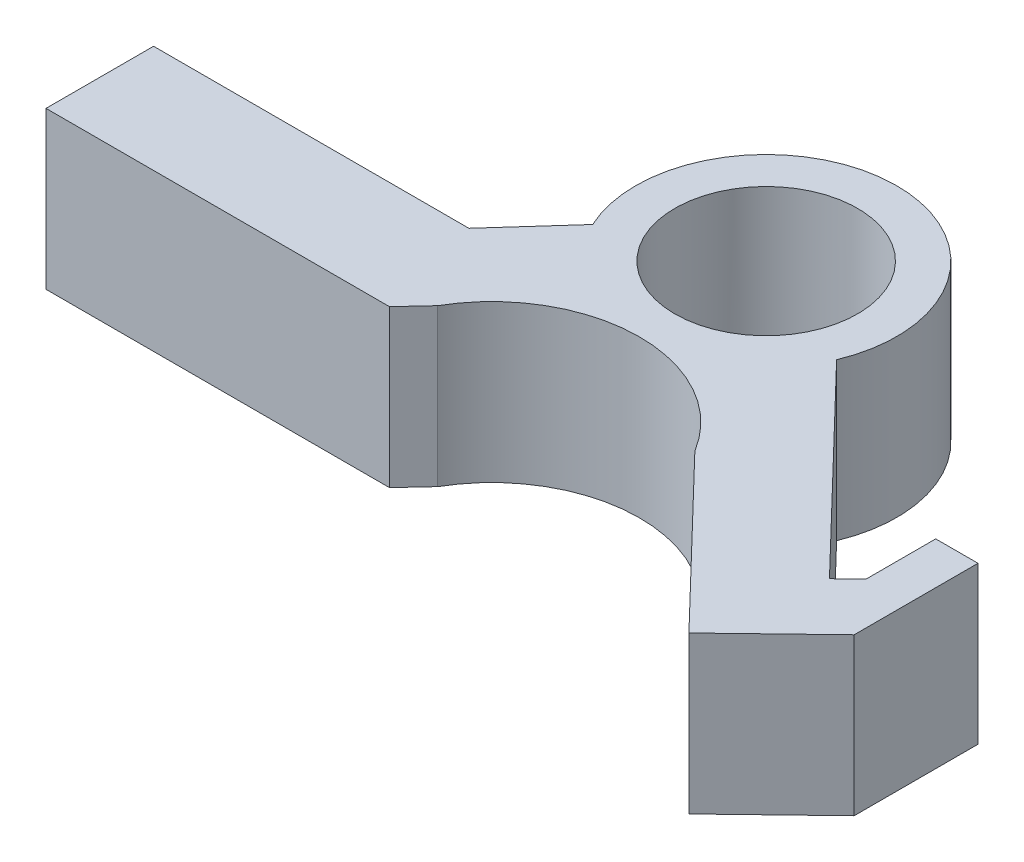
from build123d import *

# Parameters (mm, degrees)
EXTRUDE_1_DEPTH     = 3
SKETCH_3_R          = 1.75
CUT_EXTRUDE_1_DEPTH = 10


with BuildPart() as part:
    # Эскиз1 → Бобышка-Вытянуть1 (new body)
    with BuildSketch(Plane(origin=(0, 0, 0), x_dir=(1, 0, 0), z_dir=(0, 1, 0))):
        with BuildLine():
            Line((1.303877519, 4.981364115), (2.425804873, 6.229215237))
            ThreePointArc((2.425804873, 6.229215237), (4.642715437, 9.781674692), (7.001370076, 6.321702305))
            Line((7.001370076, 6.321702305), (10.562616141, 2.623485237))
            Line((10.562616141, 2.623485237), (10.919592499, 2.967240249))
            Line((10.919592499, 2.967240249), (10.919592499, 4.300759927))
            Line((10.919592499, 4.300759927), (11.728649514, 4.300759927))
            Line((11.728649514, 4.300759927), (11.728649514, 3.252739503))
            Line((11.728649514, 3.252739503), (11.728649514, 1.930836158))
            Line((11.728649514, 1.930836158), (10.117222577, 0.3790917))
            Line((10.117222577, 0.3790917), (7.157448349, 3.452703399))
            ThreePointArc((7.157448349, 3.452703399), (4.707383461, 4.814595243), (2.287238645, 3.400216789))
            Line((2.287238645, 3.400216789), (1.842702366, 2.922219258))
            Line((1.842702366, 2.922219258), (-0.547473895, 2.922219258))
            Line((-0.547473895, 2.922219258), (-4.731054927, 2.922219258))
            Line((-4.731054927, 2.922219258), (-4.731054927, 4.981364115))
            Line((-4.731054927, 4.981364115), (1.303877519, 4.981364115))
        make_face()
    extrude(amount=EXTRUDE_1_DEPTH)

    # Эскиз3 → Вырез-Вытянуть1 (cut)
    with BuildSketch(Plane(origin=(0, 3, 0), x_dir=(1, 0, 0), z_dir=(0, 1, 0))):
        with Locations(Location((4.693238255, 7.282185255, 0), (0, 0, 270))):
            Circle(SKETCH_3_R)
    extrude(amount=-CUT_EXTRUDE_1_DEPTH, mode=Mode.SUBTRACT)


solid = part.part
